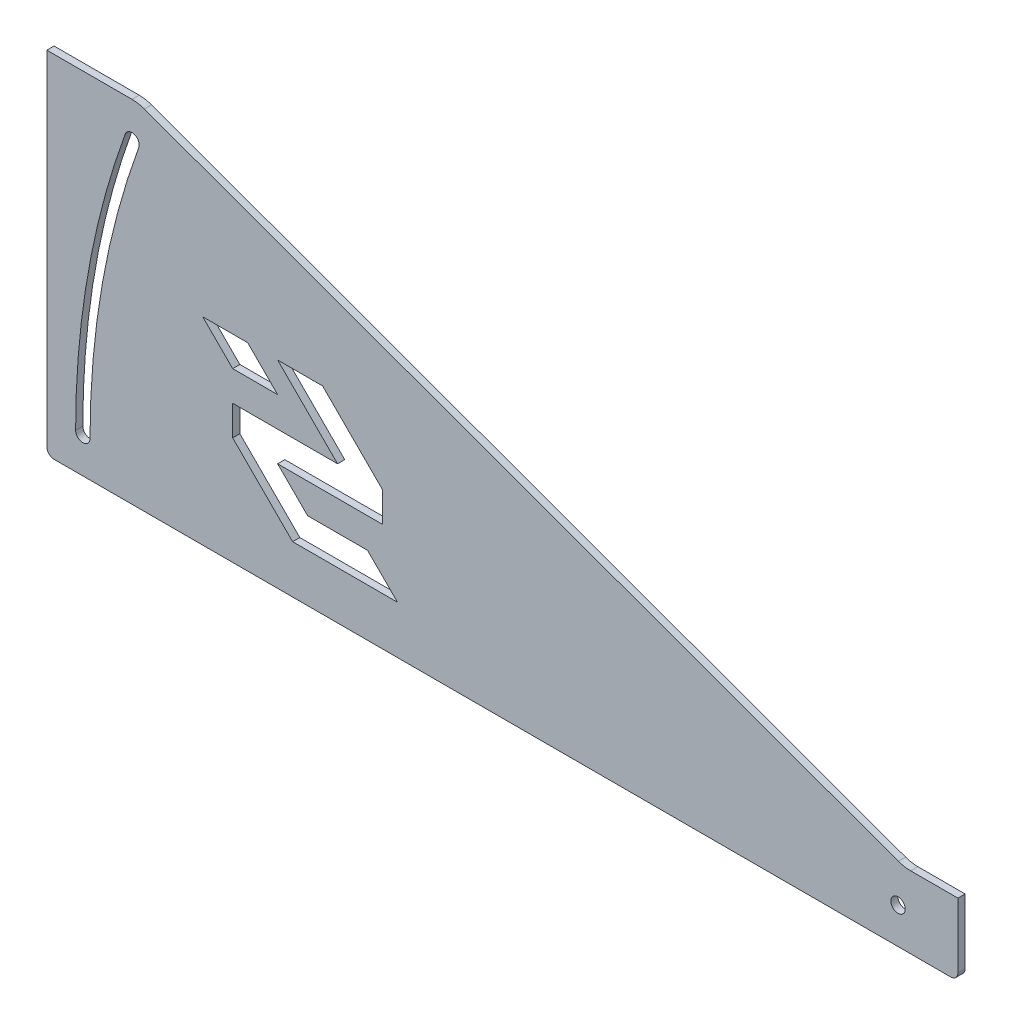
from build123d import *

# Parameters (mm, degrees)
BOSS_EXTRUDE1_DEPTH = 3
FILLET1_R           = 15
FILLET2_R           = 3
CUT_EXTRUDE2_REACH  = 210.288


with BuildPart() as part:
    # Sketch1 → Boss-Extrude1 (new body)
    with BuildSketch(Plane.XY):
        with BuildLine():
            Line((172.644904711, -43.143424365), (-141.232259922, 71.098520777))
            ThreePointArc((-141.232259922, 71.098520777), (-144.032153784, 64.138243883), (-146.676413136, 57.117364125))
            ThreePointArc((-146.676413136, 57.117364125), (-148.639759836, 51.573044096), (-150.506045786, 45.99530337))
            ThreePointArc((-150.506045786, 45.99530337), (-152.274702625, 40.385840566), (-153.945191461, 34.746364791))
            ThreePointArc((-153.945191461, 34.746364791), (-155.517003393, 29.078594081), (-156.989659693, 23.384254699))
            ThreePointArc((-156.989659693, 23.384254699), (-158.362711759, 17.665081266), (-159.635741365, 11.922815828))
            ThreePointArc((-159.635741365, 11.922815828), (-160.808360796, 6.159207212), (-161.880212786, 0.37601139))
            ThreePointArc((-161.880212786, 0.37601139), (-162.850970773, -5.425009602), (-163.720339137, -11.242089133))
            ThreePointArc((-163.720339137, -11.242089133), (-164.48805308, -17.073455447), (-165.153878721, -22.917332071))
            ThreePointArc((-165.153878721, -22.917332071), (-165.717613271, -28.771939222), (-166.179084972, -34.635493212))
            ThreePointArc((-166.179084972, -34.635493212), (-166.538153226, -40.50620738), (-166.794708707, -46.382294014))
            ThreePointArc((-166.794708707, -46.382294014), (-166.948673268, -52.261963415), (-167, -58.143424365))
            ThreePointArc((-167, -58.143424365), (-166.916491303, -65.645283328), (-166.6660066, -73.143424365))
            Line((-166.6660066, -73.143424365), (170, -73.143424365))
            ThreePointArc((170, -73.143424365), (155, -58.143424365), (170, -43.143424365))
            Line((170, -43.143424365), (172.644904711, -43.143424365))
        make_face()
        with BuildLine():
            ThreePointArc((170, -43.143424365), (155, -58.143424365), (170, -73.143424365))
            Line((170, -73.143424365), (170, -61.143424365))
            ThreePointArc((170, -61.143424365), (167, -58.143424365), (170, -55.143424365))
            Line((170, -55.143424365), (170, -43.143424365))
        make_face()
        with BuildLine():
            Line((170, -61.143424365), (170, -73.143424365))
            ThreePointArc((170, -73.143424365), (180.606601718, -68.750026083), (185, -58.143424365))
            ThreePointArc((185, -58.143424365), (182.287280664, -49.53977782), (175.13030215, -44.048035054))
            ThreePointArc((175.13030215, -44.048035054), (172.604722665, -43.37130807), (170, -43.143424365))
            Line((170, -43.143424365), (170, -55.143424365))
            ThreePointArc((170, -55.143424365), (172.121320344, -56.022104022), (173, -58.143424365))
            ThreePointArc((173, -58.143424365), (172.121320344, -60.264744709), (170, -61.143424365))
        make_face()
        with BuildLine():
            ThreePointArc((185, -58.143424365), (180.606601718, -68.750026083), (170, -73.143424365))
            Line((170, -73.143424365), (185, -73.143424365))
            Line((185, -73.143424365), (185, -58.143424365))
        make_face()
        Polygon((195, -43.143424365), (185, -43.143424365), (185, -58.143424365), (185, -73.143424365), (195, -73.143424365), align=None)
        with BuildLine():
            Line((185, -43.143424365), (172.644904711, -43.143424365))
            Line((172.644904711, -43.143424365), (175.13030215, -44.048035054))
            ThreePointArc((175.13030215, -44.048035054), (182.287280664, -49.53977782), (185, -58.143424365))
            Line((185, -58.143424365), (185, -43.143424365))
        make_face()
        with BuildLine():
            Line((-141.232259922, 71.098520777), (-144.05410977, 72.125590127))
            ThreePointArc((-144.05410977, 72.125590127), (-146.304846887, 66.561201995), (-148.457003515, 60.957948056))
            ThreePointArc((-148.457003515, 60.957948056), (-147.034245178, 59.858728616), (-146.495491067, 58.143424365))
            ThreePointArc((-146.495491067, 58.143424365), (-146.541067791, 57.622479932), (-146.676413136, 57.117364125))
            ThreePointArc((-146.676413136, 57.117364125), (-144.032153784, 64.138243883), (-141.232259922, 71.098520777))
        make_face()
        with BuildLine():
            Line((-146.850586357, 73.143424365), (-146.879730103, 73.143424365))
            ThreePointArc((-146.879730103, 73.143424365), (-149.673514203, 66.186155049), (-152.314568802, 59.169485145))
            ThreePointArc((-152.314568802, 59.169485145), (-150.757344959, 60.865137935), (-148.457003515, 60.957948056))
            ThreePointArc((-148.457003515, 60.957948056), (-146.304846887, 66.561201995), (-144.05410977, 72.125590127))
            Line((-144.05410977, 72.125590127), (-146.850586357, 73.143424365))
        make_face()
        with BuildLine():
            Line((-146.879730103, 73.143424365), (-185, 73.143424365))
            Line((-185, 73.143424365), (-185, -73.143424365))
            Line((-185, -73.143424365), (-172.671854695, -73.143424365))
            ThreePointArc((-172.671854695, -73.143424365), (-172.917953861, -65.6452188), (-173, -58.143424352))
            ThreePointArc((-173, -58.143424352), (-172.947759441, -52.157249117), (-172.791053679, -46.172897328))
            ThreePointArc((-172.791053679, -46.172897328), (-172.529930414, -40.192191247), (-172.164469198, -34.216953285))
            ThreePointArc((-172.164469198, -34.216953285), (-171.694781411, -28.249004209), (-171.12101009, -22.290161263))
            ThreePointArc((-171.12101009, -22.290161263), (-170.443329971, -16.342239237), (-169.661947511, -10.407050258))
            ThreePointArc((-169.661947511, -10.407050258), (-168.777100779, -4.486402568), (-167.789059266, 1.417900674))
            ThreePointArc((-167.789059266, 1.417900674), (-166.698123892, 7.304061207), (-165.504627005, 13.170285803))
            ThreePointArc((-165.504627005, 13.170285803), (-164.208932183, 19.01478744), (-162.811434084, 24.835785939))
            ThreePointArc((-162.811434084, 24.835785939), (-161.312558439, 30.631508024), (-159.712761785, 36.400188407))
            ThreePointArc((-159.712761785, 36.400188407), (-158.01253136, 42.140070142), (-156.212385139, 47.849404552))
            ThreePointArc((-156.212385139, 47.849404552), (-154.312871396, 53.526452713), (-152.314568802, 59.169485145))
            ThreePointArc((-152.314568802, 59.169485145), (-149.673514203, 66.186155049), (-146.879730103, 73.143424365))
        make_face()
        with BuildLine():
            ThreePointArc((-173, -58.143424352), (-172.917953861, -65.6452188), (-172.671854695, -73.143424365))
            Line((-172.671854695, -73.143424365), (-169.668956486, -73.143424365))
            ThreePointArc((-169.668956486, -73.143424365), (-169.88082472, -67.144812467), (-169.986764706, -61.14339517))
            ThreePointArc((-169.986764706, -61.14339517), (-172.116635793, -60.269418938), (-173, -58.143424352))
        make_face()
        with BuildLine():
            ThreePointArc((-169.986764706, -61.14339517), (-169.88082472, -67.144812467), (-169.668956486, -73.143424365))
            Line((-169.668956486, -73.143424365), (-166.6660066, -73.143424365))
            ThreePointArc((-166.6660066, -73.143424365), (-166.916491303, -65.645283328), (-167, -58.143424365))
            ThreePointArc((-167, -58.143424365), (-167.874005423, -60.260060153), (-169.986764706, -61.14339517))
        make_face()
        with BuildLine():
            Line((175.13030215, -44.048035054), (172.644904711, -43.143424365))
            Line((172.644904711, -43.143424365), (170, -43.143424365))
            ThreePointArc((170, -43.143424365), (172.604722665, -43.37130807), (175.13030215, -44.048035054))
        make_face()
    extrude(amount=BOSS_EXTRUDE1_DEPTH)

    # Fillet1
    fillet1_edges = [part.edges().sort_by_distance(p)[0] for p in [
        (-146.850586357, 73.143424365, 1.5),
        (172.644904711, -43.143424365, 1.5),
    ]]
    fillet(fillet1_edges, radius=FILLET1_R)

    # Fillet2
    fillet2_edges = [part.edges().sort_by_distance(p)[0] for p in [
        (-185, -73.143424365, 1.5),
        (195, -73.143424365, 1.5),
    ]]
    fillet(fillet2_edges, radius=FILLET2_R)

    # Sketch5 → Cut-Extrude2 (cut, up to next)
    with BuildSketch(Plane(origin=(0, 0, 0), x_dir=(-1, 0, 0), z_dir=(0, 0, -1)), mode=Mode.PRIVATE) as cut_extrude2_sk1:
        Polygon((107.5, 9.356575635), (95, -3.143424365), (107.5, -3.143424365), (120, 9.356575635), align=None)
    cut_extrude2_tool1 = extrude(cut_extrude2_sk1.sketch, amount=-CUT_EXTRUDE2_REACH, mode=Mode.PRIVATE) & part.part
    # Sketch5 → Cut-Extrude2 (cut, up to next)
    with BuildSketch(Plane(origin=(0, 0, 0), x_dir=(-1, 0, 0), z_dir=(0, 0, -1)), mode=Mode.PRIVATE) as cut_extrude2_sk2:
        Polygon((101.25, 9.356575635), (88.75, -3.143424365), (95, -3.143424365), (107.5, 9.356575635), align=None)
    cut_extrude2_tool2 = extrude(cut_extrude2_sk2.sketch, amount=-CUT_EXTRUDE2_REACH, mode=Mode.PRIVATE) & part.part
    # Sketch5 → Cut-Extrude2 (cut, up to next)
    with BuildSketch(Plane(origin=(0, 0, 0), x_dir=(-1, 0, 0), z_dir=(0, 0, -1)), mode=Mode.PRIVATE) as cut_extrude2_sk3:
        Polygon((70, 9.356575635), (57.5, -3.143424365), (76.25, -3.143424365), (88.75, 9.356575635), align=None)
    cut_extrude2_tool3 = extrude(cut_extrude2_sk3.sketch, amount=-CUT_EXTRUDE2_REACH, mode=Mode.PRIVATE) & part.part
    # Sketch5 → Cut-Extrude2 (cut, up to next)
    with BuildSketch(Plane(origin=(0, 0, 0), x_dir=(-1, 0, 0), z_dir=(0, 0, -1)), mode=Mode.PRIVATE) as cut_extrude2_sk4:
        Polygon((57.5, -3.143424365), (45, -15.643424365), (63.75, -15.643424365), (76.25, -3.143424365), align=None)
    cut_extrude2_tool4 = extrude(cut_extrude2_sk4.sketch, amount=-CUT_EXTRUDE2_REACH, mode=Mode.PRIVATE) & part.part
    # Sketch5 → Cut-Extrude2 (cut, up to next)
    with BuildSketch(Plane(origin=(0, 0, 0), x_dir=(-1, 0, 0), z_dir=(0, 0, -1)), mode=Mode.PRIVATE) as cut_extrude2_sk5:
        Polygon((45, -28.143424365), (51.25, -28.143424365), (63.75, -15.643424365), (45, -15.643424365), align=None)
    cut_extrude2_tool5 = extrude(cut_extrude2_sk5.sketch, amount=-CUT_EXTRUDE2_REACH, mode=Mode.PRIVATE) & part.part
    # Sketch5 → Cut-Extrude2 (cut, up to next)
    with BuildSketch(Plane(origin=(0, 0, 0), x_dir=(-1, 0, 0), z_dir=(0, 0, -1)), mode=Mode.PRIVATE) as cut_extrude2_sk6:
        Polygon((63.75, -15.643424365), (51.25, -28.143424365), (70, -28.143424365), (82.5, -15.643424365), align=None)
    cut_extrude2_tool6 = extrude(cut_extrude2_sk6.sketch, amount=-CUT_EXTRUDE2_REACH, mode=Mode.PRIVATE) & part.part
    # Sketch5 → Cut-Extrude2 (cut, up to next)
    with BuildSketch(Plane(origin=(0, 0, 0), x_dir=(-1, 0, 0), z_dir=(0, 0, -1)), mode=Mode.PRIVATE) as cut_extrude2_sk7:
        Polygon((82.5, -15.643424365), (70, -28.143424365), (88.75, -28.143424365), (101.25, -15.643424365), align=None)
    cut_extrude2_tool7 = extrude(cut_extrude2_sk7.sketch, amount=-CUT_EXTRUDE2_REACH, mode=Mode.PRIVATE) & part.part
    # Sketch5 → Cut-Extrude2 (cut, up to next)
    with BuildSketch(Plane(origin=(0, 0, 0), x_dir=(-1, 0, 0), z_dir=(0, 0, -1)), mode=Mode.PRIVATE) as cut_extrude2_sk8:
        Polygon((101.25, -15.643424365), (88.75, -28.143424365), (107.5, -28.143424365), (107.5, -15.643424365), align=None)
    cut_extrude2_tool8 = extrude(cut_extrude2_sk8.sketch, amount=-CUT_EXTRUDE2_REACH, mode=Mode.PRIVATE) & part.part
    # Sketch5 → Cut-Extrude2 (cut, up to next)
    with BuildSketch(Plane(origin=(0, 0, 0), x_dir=(-1, 0, 0), z_dir=(0, 0, -1)), mode=Mode.PRIVATE) as cut_extrude2_sk9:
        Polygon((88.75, -28.143424365), (76.25, -40.643424365), (95, -40.643424365), (107.5, -28.143424365), align=None)
    cut_extrude2_tool9 = extrude(cut_extrude2_sk9.sketch, amount=-CUT_EXTRUDE2_REACH, mode=Mode.PRIVATE) & part.part
    # Sketch5 → Cut-Extrude2 (cut, up to next)
    with BuildSketch(Plane(origin=(0, 0, 0), x_dir=(-1, 0, 0), z_dir=(0, 0, -1)), mode=Mode.PRIVATE) as cut_extrude2_sk10:
        Polygon((76.25, -40.643424365), (63.75, -53.143424365), (82.5, -53.143424365), (95, -40.643424365), align=None)
    cut_extrude2_tool10 = extrude(cut_extrude2_sk10.sketch, amount=-CUT_EXTRUDE2_REACH, mode=Mode.PRIVATE) & part.part
    # Sketch5 → Cut-Extrude2 (cut, up to next)
    with BuildSketch(Plane(origin=(0, 0, 0), x_dir=(-1, 0, 0), z_dir=(0, 0, -1)), mode=Mode.PRIVATE) as cut_extrude2_sk11:
        Polygon((57.5, -40.643424365), (45, -53.143424365), (63.75, -53.143424365), (76.25, -40.643424365), align=None)
    cut_extrude2_tool11 = extrude(cut_extrude2_sk11.sketch, amount=-CUT_EXTRUDE2_REACH, mode=Mode.PRIVATE) & part.part
    # Sketch5 → Cut-Extrude2 (cut, up to next)
    with BuildSketch(Plane(origin=(0, 0, 0), x_dir=(-1, 0, 0), z_dir=(0, 0, -1)), mode=Mode.PRIVATE) as cut_extrude2_sk12:
        Polygon((51.25, -40.643424365), (38.75, -53.143424365), (45, -53.143424365), (57.5, -40.643424365), align=None)
    cut_extrude2_tool12 = extrude(cut_extrude2_sk12.sketch, amount=-CUT_EXTRUDE2_REACH, mode=Mode.PRIVATE) & part.part
    add(cut_extrude2_tool1.solids().sort_by_distance((-107.5, 3.106576, 0))[0], mode=Mode.SUBTRACT)
    add(cut_extrude2_tool2.solids().sort_by_distance((-98.125, 3.106576, 0))[0], mode=Mode.SUBTRACT)
    add(cut_extrude2_tool3.solids().sort_by_distance((-73.125, 3.106576, 0))[0], mode=Mode.SUBTRACT)
    add(cut_extrude2_tool4.solids().sort_by_distance((-60.625, -9.393424, 0))[0], mode=Mode.SUBTRACT)
    add(cut_extrude2_tool5.solids().sort_by_distance((-51.770833, -20.851758, 0))[0], mode=Mode.SUBTRACT)
    add(cut_extrude2_tool6.solids().sort_by_distance((-66.875, -21.893424, 0))[0], mode=Mode.SUBTRACT)
    add(cut_extrude2_tool7.solids().sort_by_distance((-85.625, -21.893424, 0))[0], mode=Mode.SUBTRACT)
    add(cut_extrude2_tool8.solids().sort_by_distance((-100.729167, -22.935091, 0))[0], mode=Mode.SUBTRACT)
    add(cut_extrude2_tool9.solids().sort_by_distance((-91.875, -34.393424, 0))[0], mode=Mode.SUBTRACT)
    add(cut_extrude2_tool10.solids().sort_by_distance((-79.375, -46.893424, 0))[0], mode=Mode.SUBTRACT)
    add(cut_extrude2_tool11.solids().sort_by_distance((-60.625, -46.893424, 0))[0], mode=Mode.SUBTRACT)
    add(cut_extrude2_tool12.solids().sort_by_distance((-48.125, -46.893424, 0))[0], mode=Mode.SUBTRACT)


solid = part.part
